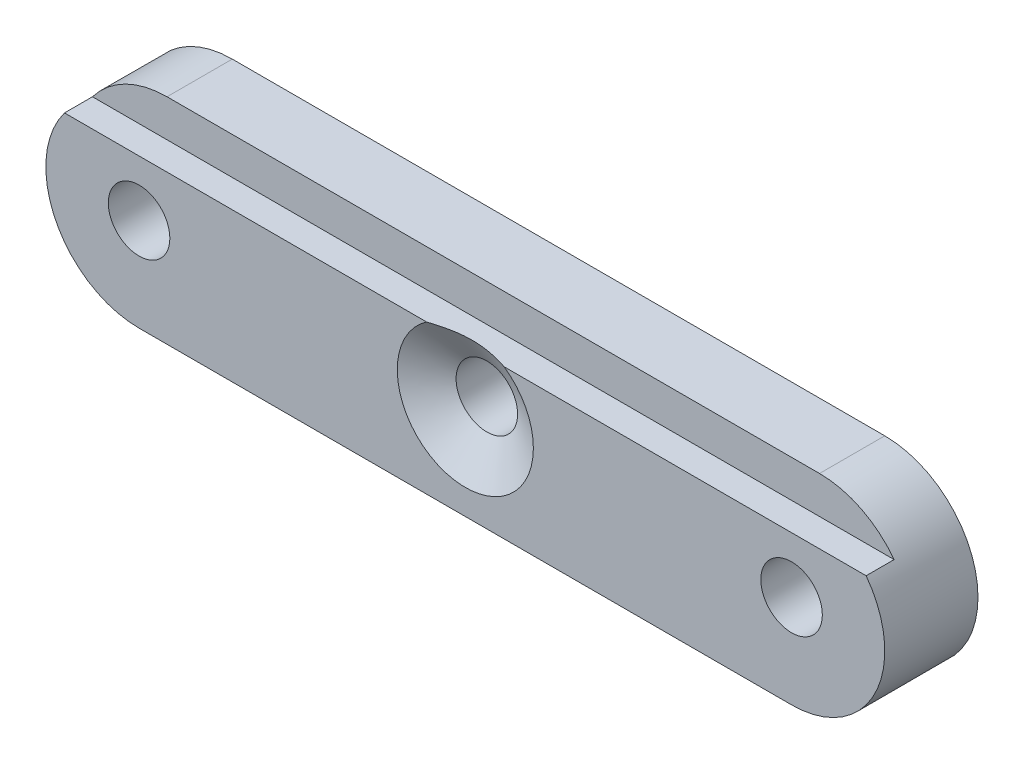
from build123d import *

# Parameters (mm, degrees)
SKETCH1_R           = 1.65
BOSS_EXTRUDE1_DEPTH = 5
SKETCH2_R           = 1.65
CUT_EXTRUDE1_DEPTH  = 5
CHAMFER1_SIZE       = 2
CHAMFER1_SIZE2      = 1.154700538
SKETCH3_W           = 1.5
SKETCH3_H           = 2
CUT_EXTRUDE2_DEPTH  = 47.5


with BuildPart() as part:
    # Sketch1 → Boss-Extrude1 (new body)
    with BuildSketch(Plane.XY):
        with BuildLine():
            Line((0, 5), (35, 5))
            ThreePointArc((35, 5), (40, 0), (35, -5))
            Line((35, -5), (0, -5))
            ThreePointArc((0, -5), (-5, 0), (0, 5))
        make_face()
        with Locations((35, 0)):
            Circle(SKETCH1_R, mode=Mode.SUBTRACT)
        Circle(SKETCH1_R, mode=Mode.SUBTRACT)
    extrude(amount=BOSS_EXTRUDE1_DEPTH)

    # Sketch2 → Cut-Extrude1 (cut)
    with BuildSketch(Plane.XY.offset(5)):
        with Locations((17.5, 0)):
            Circle(SKETCH2_R)
    extrude(amount=-CUT_EXTRUDE1_DEPTH, mode=Mode.SUBTRACT)

    # Chamfer1
    chamfer1_edges = [part.edges().sort_by_distance(p)[0] for p in [
        (15.85, 0, 5),
    ]]
    chamfer1_side = [part.faces().sort_by_distance(p)[0] for p in [
        (17.5, 4.539022777, 5),
    ]]
    chamfer(chamfer1_edges, length=CHAMFER1_SIZE, length2=CHAMFER1_SIZE2, reference=chamfer1_side[0])

    # Sketch3 → Cut-Extrude2 (cut, symmetric)
    with BuildSketch(Plane(origin=(0, 0, 0), x_dir=(0, 0, -1), z_dir=(1, 0, 0))):
        with Locations((-4.25, 4)):
            Rectangle(SKETCH3_W, SKETCH3_H)
    extrude(amount=CUT_EXTRUDE2_DEPTH, both=True, mode=Mode.SUBTRACT)


solid = part.part
